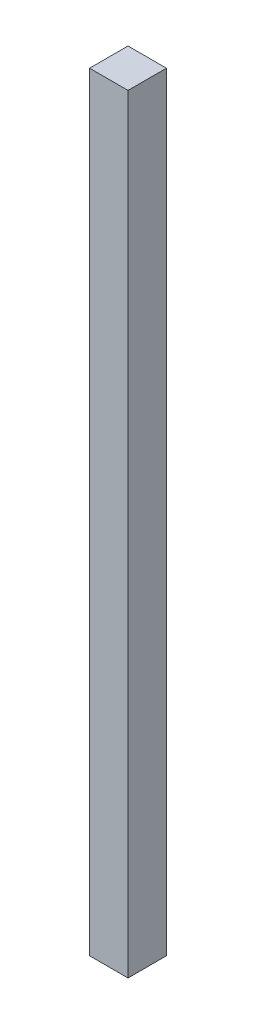
from build123d import *

# Parameters (mm, degrees)
SKETCH1_W           = 2
SKETCH1_H           = 2
BOSS_EXTRUDE1_DEPTH = 40


with BuildPart() as part:
    # Sketch1 → Boss-Extrude1 (new body)
    with BuildSketch(Plane(origin=(0, 0, 0), x_dir=(1, 0, 0), z_dir=(0, 1, 0))):
        with Locations((1, -1)):
            Rectangle(SKETCH1_W, SKETCH1_H)
    extrude(amount=BOSS_EXTRUDE1_DEPTH)


solid = part.part
